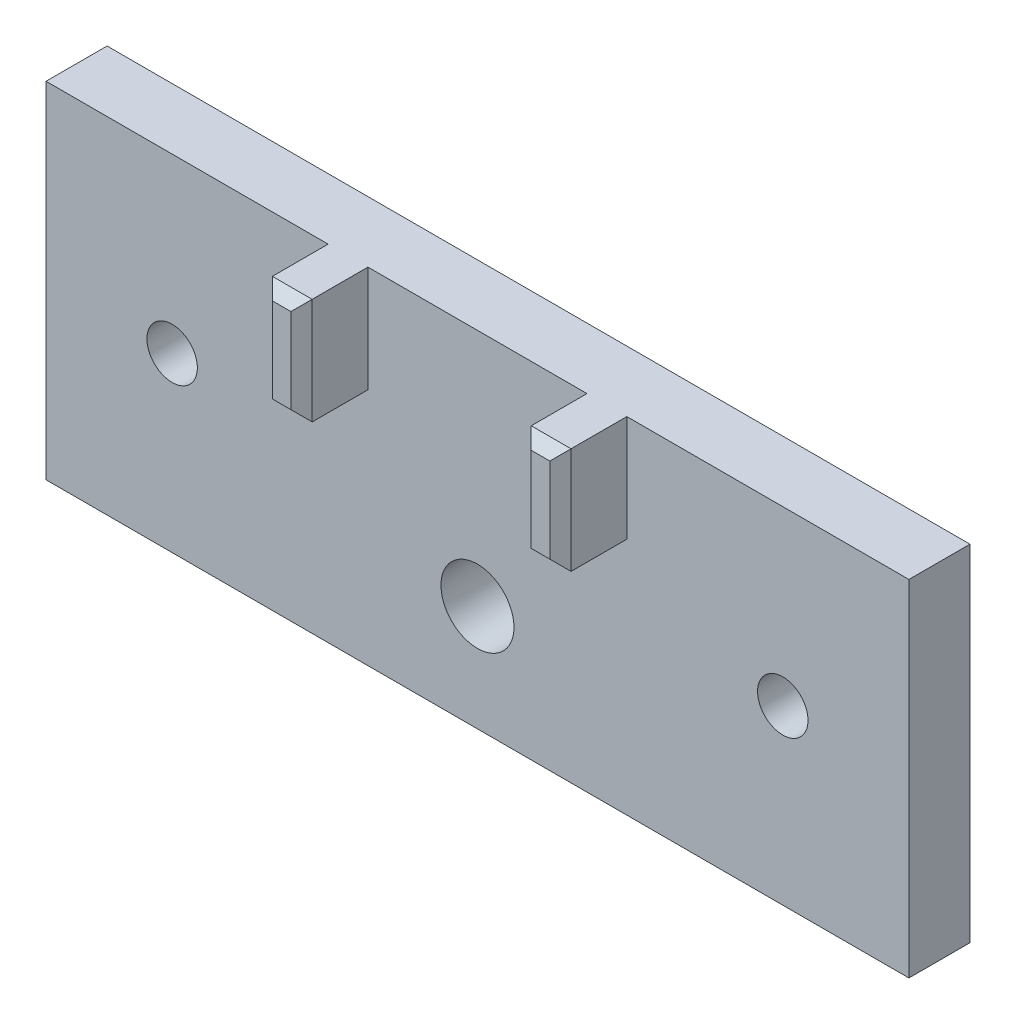
from build123d import *

# Parameters (mm, degrees)
SKETCH1_W           = 65
SKETCH1_H           = 26
BOSS_EXTRUDE1_DEPTH = 5
SKETCH2_R           = 2.75
CUT_EXTRUDE1_DEPTH  = 5
SKETCH3_W           = 3
SKETCH3_H           = 8
BOSS_EXTRUDE2_DEPTH = 5
CHAMFER1_SIZE       = 0.8
SKETCH4_R           = 1.9
CUT_EXTRUDE2_DEPTH  = 5
CHAMFER2_SIZE       = 0.4


with BuildPart() as part:
    # Sketch1 → Boss-Extrude1 (new body)
    with BuildSketch(Plane.XY):
        with Locations((32.5, 13)):
            Rectangle(SKETCH1_W, SKETCH1_H)
    extrude(amount=BOSS_EXTRUDE1_DEPTH)

    # Sketch2 → Cut-Extrude1 (cut)
    with BuildSketch(Plane.XY.offset(5)):
        with Locations((32.5, 8)):
            Circle(SKETCH2_R)
    extrude(amount=-CUT_EXTRUDE1_DEPTH, mode=Mode.SUBTRACT)

    # Sketch3 → Boss-Extrude2 (add)
    with BuildSketch(Plane.XY.offset(5)):
        with Locations((22.75, 22)):
            Rectangle(SKETCH3_W, SKETCH3_H)
        with Locations((42.25, 22)):
            Rectangle(SKETCH3_W, SKETCH3_H)
    extrude(amount=BOSS_EXTRUDE2_DEPTH)

    # Chamfer1
    chamfer1_edges = [part.edges().sort_by_distance(p)[0] for p in [
        (21.25, 22, 10),
        (22.75, 18, 10),
        (24.25, 22, 10),
        (22.75, 26, 10),
        (40.75, 22, 10),
        (42.25, 18, 10),
        (43.75, 22, 10),
        (42.25, 26, 10),
    ]]
    chamfer(chamfer1_edges, length=CHAMFER1_SIZE)

    # Sketch4 → Cut-Extrude2 (cut)
    with BuildSketch(Plane(origin=(0, 0, 0), x_dir=(-1, 0, 0), z_dir=(0, 0, -1))):
        with Locations((-55.5, 13)):
            Circle(SKETCH4_R)
        with Locations((-9.5, 13)):
            Circle(SKETCH4_R)
    extrude(amount=-CUT_EXTRUDE2_DEPTH, mode=Mode.SUBTRACT)

    # Chamfer2
    chamfer2_edges = [part.edges().sort_by_distance(p)[0] for p in [
        (29.75, 8, 0),
        (32.5, 26, 0),
        (65, 13, 0),
        (32.5, 0, 0),
        (0, 13, 0),
        (57.4, 13, 0),
        (11.4, 13, 0),
    ]]
    chamfer(chamfer2_edges, length=CHAMFER2_SIZE)


solid = part.part
